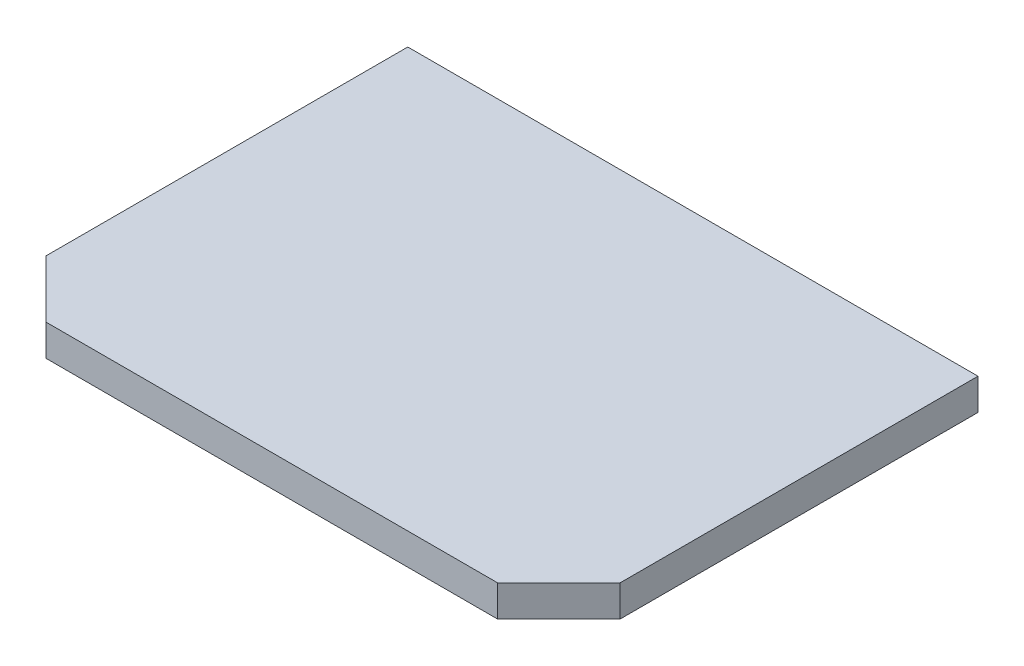
from build123d import *

# Parameters (mm, degrees)
EXTRUDE_1_DEPTH          = 5.124133
EXTRUDE_1_DEPTH_BACK     = 12
EXTRUDE_2_DEPTH          = 10
CUT_EXTRUDE_1_DEPTH      = 25.003853471
CUT_EXTRUDE_1_DEPTH_BACK = 25.003853471


with BuildPart() as part:
    # 草图1 → 凸台-拉伸1 (new, two sides: drawn at the far end of the back side and taken through both)
    with BuildSketch(Plane.XY.offset(-EXTRUDE_1_DEPTH_BACK)):
        Polygon((-16.127330455, 4), (-16.127330455, 3.2), (-11.127330455, 3.2), (11.127330455, 3.200000056), (16.127758191, 3.200000069), (16.127758191, 4), (11.027330455, 4), (11.027330455, 5.1), (18.100330201, 5.1), (18.100330201, 7.1), (-18.227330455, 7.1), (-18.227330455, 5.1), (-11.027330455, 5.1), (-11.027330455, 4), align=None)
    extrude(amount=EXTRUDE_1_DEPTH + EXTRUDE_1_DEPTH_BACK)

    # 草图2 → 凸台-拉伸2 (add)
    with BuildSketch(Plane.XY.offset(5.12413323)):
        Polygon((11.027330455, 5.1), (-11.027330455, 5.1), (-18.227330455, 5.1), (-18.227330455, 7.1), (18.100330201, 7.1), (18.100330201, 5.1), align=None)
    extrude(amount=EXTRUDE_2_DEPTH)

    # 草图3 → 切除-拉伸1 (cut, two sides: drawn at the far end of the back side and taken through both)
    with BuildSketch(Plane(origin=(0, 7.1, 0), x_dir=(1, 0, 0), z_dir=(0, 1, 0)).offset(-CUT_EXTRUDE_1_DEPTH_BACK)):
        Polygon((18.100330201, -5.12413323), (18.100330201, -10.794403278), (18.100330201, -15.12413323), (-18.227330455, -15.12413323), (-18.227330455, -11.048403786), (-18.227330455, -5.12413323), (-20.378002423, -5.448805372), (-20.378002423, -17.361495583), (22.540888442, -17.361495583), (22.540888442, -5.12413323), align=None)
        Polygon((18.100330201, -15.12413323), (18.100330201, -10.794403278), (14.191406072, -14.703327407), (-14.572406834, -14.703327407), (-18.227330455, -11.048403786), (-18.227330455, -15.12413323), align=None)
    extrude(amount=CUT_EXTRUDE_1_DEPTH + CUT_EXTRUDE_1_DEPTH_BACK, mode=Mode.SUBTRACT)


solid = part.part
